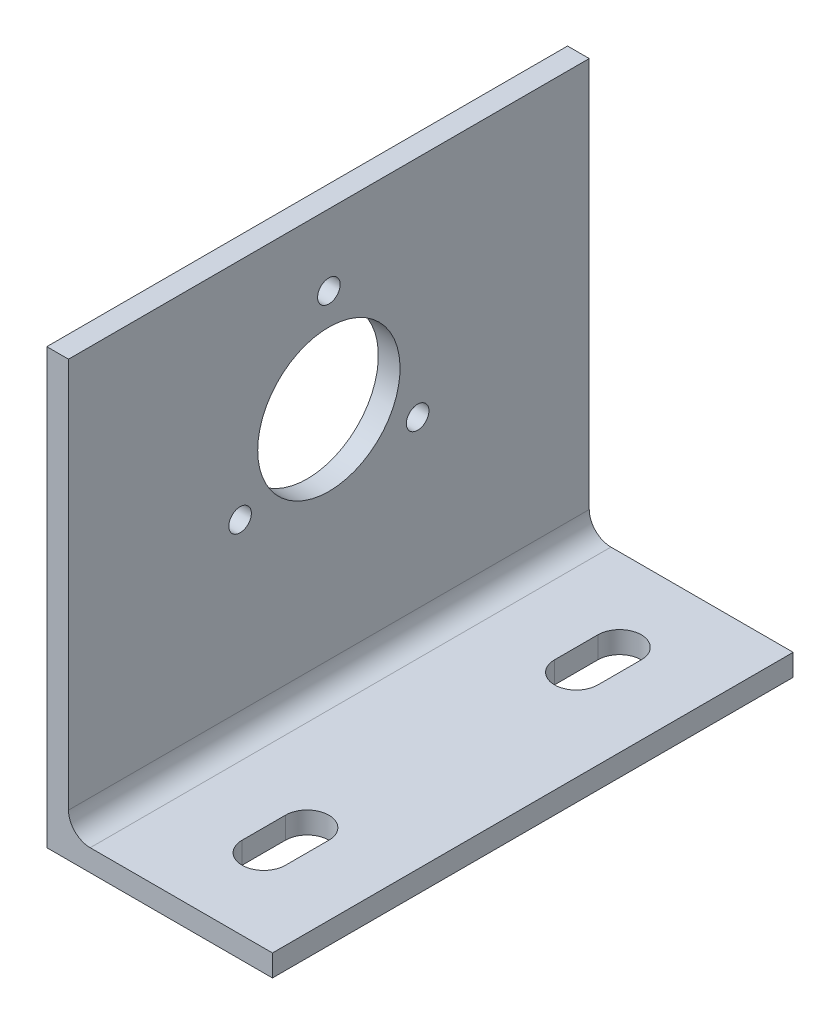
from build123d import *

# Parameters (mm, degrees)
BOSS_EXTRUDE1_DEPTH = 76.2
FILLET1_R           = 3.175
SKETCH2_R           = 10.414
SKETCH2_R_2         = 1.651
CUT_EXTRUDE2_DEPTH  = 142.990316571
SKETCH4_W           = 68.58
SKETCH4_H           = 76.2
CUT_EXTRUDE3_DEPTH  = 141.599095392
CUT_EXTRUDE4_DEPTH  = 103.644366748


with BuildPart() as part:
    # Sketch1 → Boss-Extrude1 (new body)
    with BuildSketch(Plane.XY):
        Polygon((0, 0), (0, 63.5), (3.175, 63.5), (3.175, 3.175), (101.6, 3.175), (101.6, 0), align=None)
    extrude(amount=BOSS_EXTRUDE1_DEPTH)

    # Fillet1
    fillet1_edges = [part.edges().sort_by_distance(p)[0] for p in [
        (3.175, 3.175, 38.1),
    ]]
    fillet(fillet1_edges, radius=FILLET1_R)

    # Sketch2 → Cut-Extrude2 (cut, through all)
    with BuildSketch(Plane.ZY):
        with Locations((38.1, 38.1)):
            Circle(SKETCH2_R)
        with Locations((38.1, 53.1)):
            Circle(SKETCH2_R_2)
        with Locations((25.109618943, 30.6)):
            Circle(SKETCH2_R_2)
        with Locations((51.090381057, 30.6)):
            Circle(SKETCH2_R_2)
    extrude(amount=-CUT_EXTRUDE2_DEPTH, mode=Mode.SUBTRACT)

    # Sketch4 → Cut-Extrude3 (cut, through all)
    with BuildSketch(Plane(origin=(0, 3.175, 0), x_dir=(1, 0, 0), z_dir=(0, 1, 0))):
        with Locations((67.31, -38.1)):
            Rectangle(SKETCH4_W, SKETCH4_H)
    extrude(amount=-CUT_EXTRUDE3_DEPTH, mode=Mode.SUBTRACT)

    # Sketch5 → Cut-Extrude4 (cut, through all)
    with BuildSketch(Plane(origin=(0, 3.175, 0), x_dir=(1, 0, 0), z_dir=(0, 1, 0))):
        with BuildLine():
            Line((22.86, -12.065), (22.86, -18.415))
            ThreePointArc((22.86, -18.415), (19.685, -21.59), (16.51, -18.415))
            Line((16.51, -18.415), (16.51, -12.065))
            ThreePointArc((16.51, -12.065), (19.685, -8.89), (22.86, -12.065))
        make_face()
        with BuildLine():
            Line((22.86, -64.135), (22.86, -57.785))
            ThreePointArc((22.86, -57.785), (19.685, -54.61), (16.51, -57.785))
            Line((16.51, -57.785), (16.51, -64.135))
            ThreePointArc((16.51, -64.135), (19.685, -67.31), (22.86, -64.135))
        make_face()
    extrude(amount=-CUT_EXTRUDE4_DEPTH, mode=Mode.SUBTRACT)


solid = part.part
